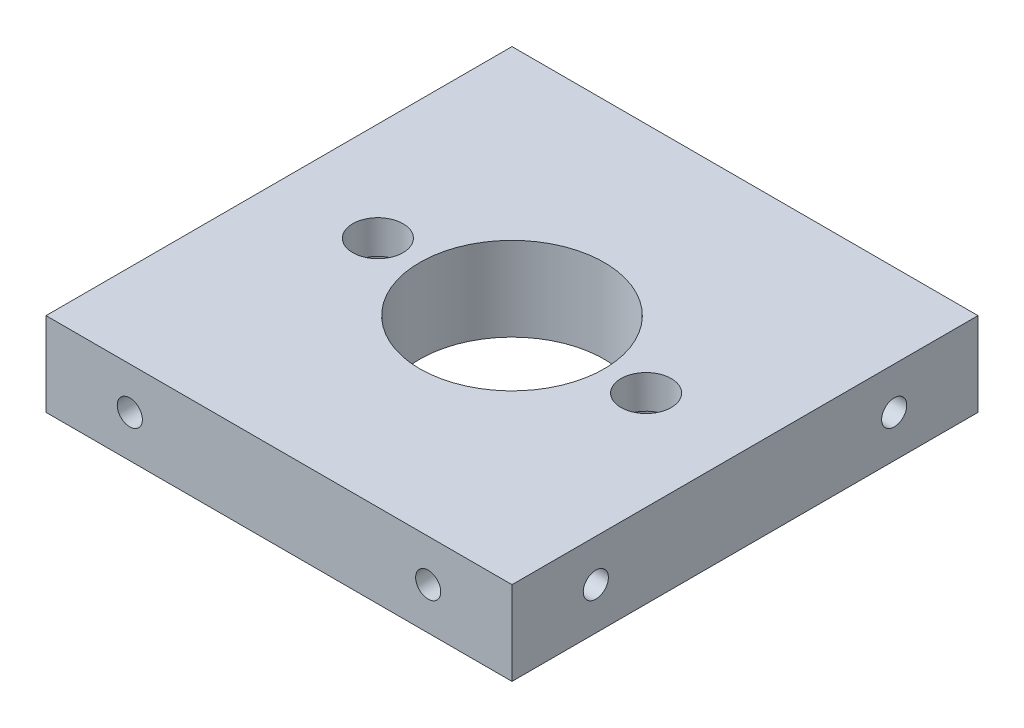
from build123d import *

# Parameters (mm, degrees)
SKETCH_1_W          = 27.8
SKETCH_1_H          = 27.8
SKETCH_1_R          = 5.5
EXTRUDE_1_DEPTH     = 5
SKETCH_1_15_R       = 1.5
CUT_EXTRUDE_1_DEPTH = 32.480946619
SKETCH_1_16_R       = 2.25
CUT_EXTRUDE_2_DEPTH = 3
SKETCH_2_R          = 0.75
CUT_EXTRUDE_3_DEPTH = 4
CUT_EXTRUDE_START   = -23.8
SKETCH_2_3_R        = 0.75
CUT_EXTRUDE_4_DEPTH = 4
SKETCH_3_R          = 0.75
CUT_EXTRUDE_5_DEPTH = 4
SKETCH_3_3_R        = 0.75
CUT_EXTRUDE_6_DEPTH = 4


with BuildPart() as part:
    # 草图1 → 凸台-拉伸1 (new body)
    with BuildSketch(Plane(origin=(0, 0, 0), x_dir=(1, 0, 0), z_dir=(0, 1, 0))):
        with Locations((13.9, 0)):
            Rectangle(SKETCH_1_W, SKETCH_1_H)
        with Locations(Location((13.9, 0, 0), (0, 0, 270))):
            Circle(SKETCH_1_R, mode=Mode.SUBTRACT)
    extrude(amount=EXTRUDE_1_DEPTH)

    # 草图1<15> → 切除-拉伸1 (cut, through all)
    with BuildSketch(Plane(origin=(0, 0, 0), x_dir=(1, 0, 0), z_dir=(0, 1, 0))):
        with Locations(Location((5.9, 0, 0), (0, 0, 270))):
            Circle(SKETCH_1_15_R)
        with Locations(Location((21.9, 0, 0), (0, 0, 270))):
            Circle(SKETCH_1_15_R)
    extrude(amount=CUT_EXTRUDE_1_DEPTH, mode=Mode.SUBTRACT)

    # 草图1<16> → 切除-拉伸2 (cut)
    with BuildSketch(Plane(origin=(0, 0, 0), x_dir=(1, 0, 0), z_dir=(0, 1, 0))):
        with Locations(Location((5.9, 0, 0), (0, 0, 90))):
            Circle(SKETCH_1_16_R)
        with Locations(Location((21.9, 0, 0), (0, 0, 90))):
            Circle(SKETCH_1_16_R)
    extrude(amount=CUT_EXTRUDE_2_DEPTH, mode=Mode.SUBTRACT)

    # 草图2 → 切除-拉伸3 (cut)
    with BuildSketch(Plane(origin=(0, 0, -13.9), x_dir=(-1, 0, 0), z_dir=(0, 0, -1))):
        with Locations((-22.8, 2.5)):
            Circle(SKETCH_2_R)
        with Locations((-5, 2.5)):
            Circle(SKETCH_2_R)
    extrude(amount=-CUT_EXTRUDE_3_DEPTH, mode=Mode.SUBTRACT)

    # 草图2<3> → 切除-拉伸4 (cut)
    with BuildSketch(Plane(origin=(0, 0, -13.9), x_dir=(-1, 0, 0), z_dir=(0, 0, -1)).offset(CUT_EXTRUDE_START)):
        with Locations((-22.8, 2.5)):
            Circle(SKETCH_2_3_R)
        with Locations((-5, 2.5)):
            Circle(SKETCH_2_3_R)
    extrude(amount=-CUT_EXTRUDE_4_DEPTH, mode=Mode.SUBTRACT)

    # 草图3 → 切除-拉伸5 (cut)
    with BuildSketch(Plane.ZY):
        with Locations((-8.9, 2.5)):
            Circle(SKETCH_3_R)
        with Locations((8.9, 2.5)):
            Circle(SKETCH_3_R)
    extrude(amount=-CUT_EXTRUDE_5_DEPTH, mode=Mode.SUBTRACT)

    # 草图3<3> → 切除-拉伸6 (cut)
    with BuildSketch(Plane.ZY.offset(CUT_EXTRUDE_START)):
        with Locations((-8.9, 2.5)):
            Circle(SKETCH_3_3_R)
        with Locations((8.9, 2.5)):
            Circle(SKETCH_3_3_R)
    extrude(amount=-CUT_EXTRUDE_6_DEPTH, mode=Mode.SUBTRACT)


solid = part.part
